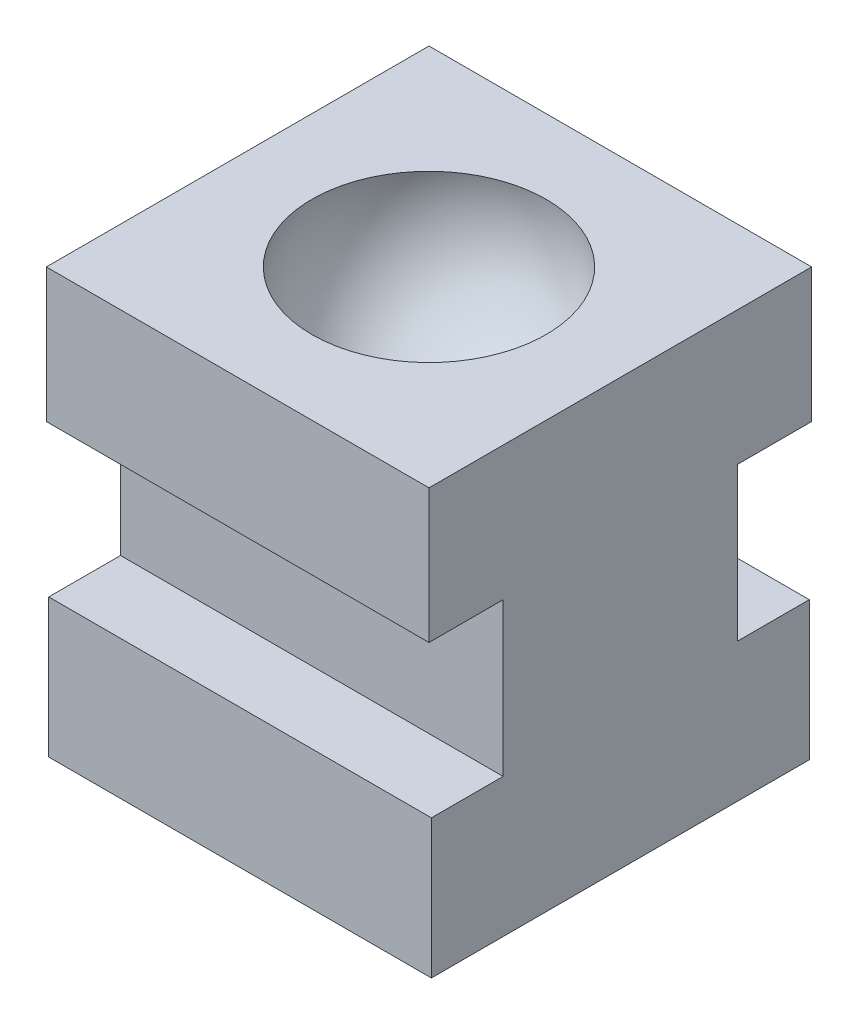
from build123d import *

# Parameters (mm, degrees)
SKETCH1_W           = 8
SKETCH1_H           = 7.9
BOSS_EXTRUDE1_DEPTH = 2.9
SKETCH2_W           = 8
SKETCH2_H           = 4.9
BOSS_EXTRUDE2_DEPTH = 6
SKETCH4_W           = 8
SKETCH4_H           = 2.8
BOSS_EXTRUDE3_DEPTH = 8


with BuildPart() as part:
    # Sketch1 → Boss-Extrude1 (new body)
    with BuildSketch(Plane(origin=(0, 0, 0), x_dir=(1, 0, 0), z_dir=(0, 1, 0))):
        with Locations((4, 3.95)):
            Rectangle(SKETCH1_W, SKETCH1_H)
    extrude(amount=BOSS_EXTRUDE1_DEPTH)

    # Sketch2 → Boss-Extrude2 (add)
    with BuildSketch(Plane(origin=(0, 2.9, 0), x_dir=(1, 0, 0), z_dir=(0, 1, 0))):
        with Locations((4, 3.95)):
            Rectangle(SKETCH2_W, SKETCH2_H)
    extrude(amount=BOSS_EXTRUDE2_DEPTH)

    # Sketch4 → Boss-Extrude3 (add, through all)
    with BuildSketch(Plane.ZY):
        with Locations((-3.95, 7.5)):
            Rectangle(SKETCH4_W, SKETCH4_H)
    extrude(amount=-BOSS_EXTRUDE3_DEPTH)

    # Sketch3 → Cut-Revolve2 (revolve, cut)
    with BuildSketch(Plane.ZY.offset(-4)):
        with BuildLine():
            Line((-3.95, 8.9), (-6.399489743, 8.9))
            ThreePointArc((-6.399489743, 8.9), (-5.886491673, 6.81886117), (-3.95, 5.9))
            Line((-3.95, 5.9), (-3.95, 8.9))
        make_face()
    revolve(axis=Axis((4, 8.9, -3.95), (0, -1, 0)), mode=Mode.SUBTRACT)


solid = part.part
